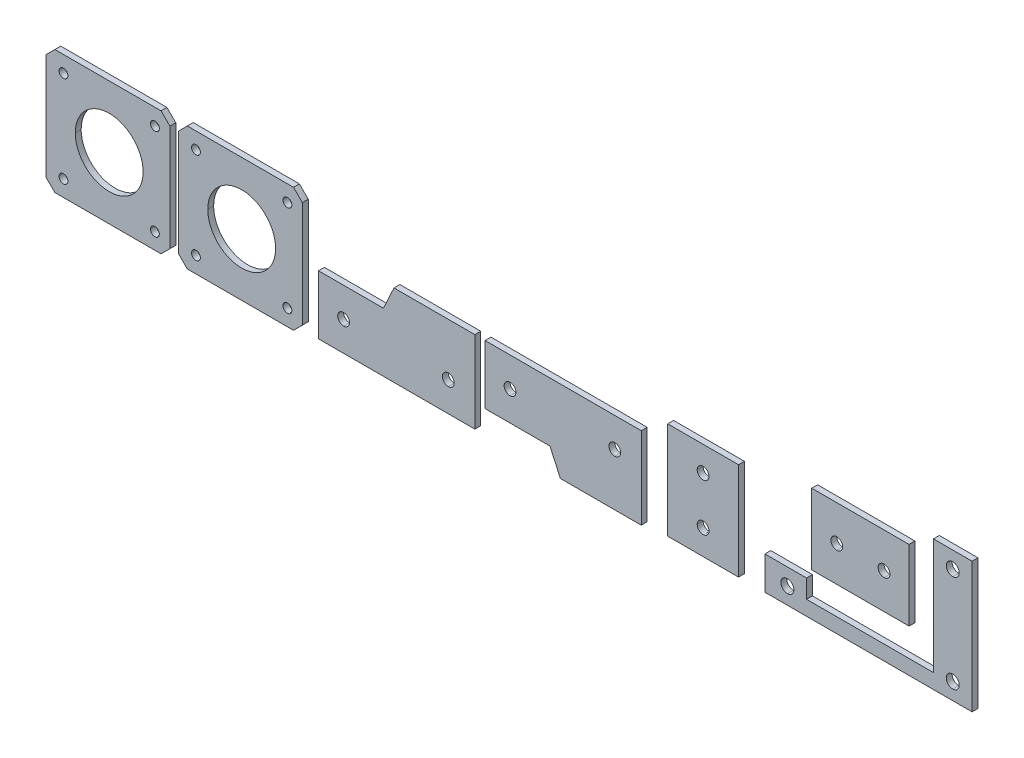
from build123d import *

# Parameters (mm, degrees)
BOSS_EXTRUDE1_DEPTH   = 2
BOSS_EXTRUDE1_2_DEPTH = 2
BOSS_EXTRUDE1_3_DEPTH = 2
BOSS_EXTRUDE1_4_DEPTH = 2
MODEL_W               = 23.999999994
MODEL_H               = 32.999999992
BOSS_EXTRUDE1_5_DEPTH = 2
BOSS_EXTRUDE1_6_DEPTH = 2
BOSS_EXTRUDE1_7_DEPTH = 2


with BuildPart() as part:
    # Model → Boss-Extrude1 (new body)
    with BuildSketch(Plane.XY):
        Polygon((1.931396224, 39.242749239), (1.931396224, 3.242764804), (4.931383092, 0.242742583), (40.931401896, 0.242742583), (43.931391553, 3.242764804), (43.931391553, 39.242749239), (40.931401896, 42.242736183), (4.931383092, 42.242736183), align=None)
        with BuildLine():
            add(Edge.make_bspline(
                [(6.357346111, 36.733899518), (6.357346111, 37.562327573), (7.028893872, 38.233910629), (7.857321907, 38.233910629), (8.685749941, 38.233910629), (9.357332979, 37.562327573), (9.357332979, 36.733899518)],
                knots=[2, 2, 2, 2, 3, 3, 3, 4, 4, 4, 4], degree=3))
            add(Edge.make_bspline(
                [(9.357332979, 36.733899518), (9.357332979, 35.905471463), (8.685749941, 35.233888407), (7.857321907, 35.233888407), (7.028893872, 35.233888407), (6.357346111, 35.905471463), (6.357346111, 36.733899518)],
                knots=[0, 0, 0, 0, 1, 1, 1, 2, 2, 2, 2], degree=3))
        make_face(mode=Mode.SUBTRACT)
        with BuildLine():
            add(Edge.make_bspline(
                [(6.357346111, 5.733905081), (6.357346111, 6.562333137), (7.028893872, 7.233916192), (7.857321907, 7.233916192), (8.685749941, 7.233916192), (9.357332979, 6.562333137), (9.357332979, 5.733905081)],
                knots=[2, 2, 2, 2, 3, 3, 3, 4, 4, 4, 4], degree=3))
            add(Edge.make_bspline(
                [(9.357332979, 5.733905081), (9.357332979, 4.905477026), (8.685749941, 4.23389397), (7.857321907, 4.23389397), (7.028893872, 4.23389397), (6.357346111, 4.905477026), (6.357346111, 5.733905081)],
                knots=[0, 0, 0, 0, 1, 1, 1, 2, 2, 2, 2], degree=3))
        make_face(mode=Mode.SUBTRACT)
        with BuildLine():
            add(Edge.make_bspline(
                [(37.357339765, 5.733905081), (37.357339765, 6.562333137), (38.028887526, 7.233916192), (38.85731556, 7.233916192), (39.685743595, 7.233916192), (40.357326633, 6.562333137), (40.357326633, 5.733905081)],
                knots=[2, 2, 2, 2, 3, 3, 3, 4, 4, 4, 4], degree=3))
            add(Edge.make_bspline(
                [(40.357326633, 5.733905081), (40.357326633, 4.905477026), (39.685743595, 4.23389397), (38.85731556, 4.23389397), (38.028887526, 4.23389397), (37.357339765, 4.905477026), (37.357339765, 5.733905081)],
                knots=[0, 0, 0, 0, 1, 1, 1, 2, 2, 2, 2], degree=3))
        make_face(mode=Mode.SUBTRACT)
        with BuildLine():
            add(Edge.make_bspline(
                [(37.357339765, 36.733899518), (37.357339765, 37.562327573), (38.028922803, 38.233910629), (38.857350838, 38.233910629), (39.685743595, 38.233910629), (40.357326633, 37.562327573), (40.357326633, 36.733899518)],
                knots=[2, 2, 2, 2, 3, 3, 3, 4, 4, 4, 4], degree=3))
            add(Edge.make_bspline(
                [(40.357326633, 36.733899518), (40.357326633, 35.905471463), (39.685743595, 35.233888407), (38.857350838, 35.233888407), (38.028922803, 35.233888407), (37.357339765, 35.905471463), (37.357339765, 36.733899518)],
                knots=[0, 0, 0, 0, 1, 1, 1, 2, 2, 2, 2], degree=3))
        make_face(mode=Mode.SUBTRACT)
        with BuildLine():
            add(Edge.make_bspline(
                [(11.857327916, 21.2339023), (11.857327916, 27.585172298), (17.006048895, 32.733893408), (23.357318733, 32.733893408), (29.708623849, 32.733893408), (34.857344829, 27.585172298), (34.857344829, 21.2339023)],
                knots=[2, 2, 2, 2, 3, 3, 3, 4, 4, 4, 4], degree=3))
            add(Edge.make_bspline(
                [(34.857344829, 21.2339023), (34.857344829, 14.882632301), (29.708623849, 9.733911191), (23.357318733, 9.733911191), (17.006048895, 9.733911191), (11.857327916, 14.882632301), (11.857327916, 21.2339023)],
                knots=[0, 0, 0, 0, 1, 1, 1, 2, 2, 2, 2], degree=3))
        make_face(mode=Mode.SUBTRACT)
    extrude(amount=BOSS_EXTRUDE1_DEPTH)


with BuildPart() as body_2:
    # Model → Boss-Extrude1 2 (new body)
    with BuildSketch(Plane.XY):
        Polygon((46.851770172, 39.251586338), (46.851770172, 3.251601903), (49.85175704, 0.251579681), (85.851775844, 0.251579681), (88.851765501, 3.251601903), (88.851765501, 39.251586338), (85.851775844, 42.251573282), (49.85175704, 42.251573282), align=None)
        with BuildLine():
            add(Edge.make_bspline(
                [(51.277720059, 36.742736617), (51.277720059, 37.571164672), (51.94926782, 38.242747728), (52.777695854, 38.242747728), (53.606123889, 38.242747728), (54.277706927, 37.571164672), (54.277706927, 36.742736617)],
                knots=[2, 2, 2, 2, 3, 3, 3, 4, 4, 4, 4], degree=3))
            add(Edge.make_bspline(
                [(54.277706927, 36.742736617), (54.277706927, 35.914308561), (53.606123889, 35.242725506), (52.777695854, 35.242725506), (51.94926782, 35.242725506), (51.277720059, 35.914308561), (51.277720059, 36.742736617)],
                knots=[0, 0, 0, 0, 1, 1, 1, 2, 2, 2, 2], degree=3))
        make_face(mode=Mode.SUBTRACT)
        with BuildLine():
            add(Edge.make_bspline(
                [(51.277720059, 5.74274218), (51.277720059, 6.571170235), (51.94926782, 7.242753291), (52.777695854, 7.242753291), (53.606123889, 7.242753291), (54.277706927, 6.571170235), (54.277706927, 5.74274218)],
                knots=[2, 2, 2, 2, 3, 3, 3, 4, 4, 4, 4], degree=3))
            add(Edge.make_bspline(
                [(54.277706927, 5.74274218), (54.277706927, 4.914314125), (53.606123889, 4.242731069), (52.777695854, 4.242731069), (51.94926782, 4.242731069), (51.277720059, 4.914314125), (51.277720059, 5.74274218)],
                knots=[0, 0, 0, 0, 1, 1, 1, 2, 2, 2, 2], degree=3))
        make_face(mode=Mode.SUBTRACT)
        with BuildLine():
            add(Edge.make_bspline(
                [(82.277713713, 5.74274218), (82.277713713, 6.571170235), (82.949261473, 7.242753291), (83.777689508, 7.242753291), (84.606117542, 7.242753291), (85.277700581, 6.571170235), (85.277700581, 5.74274218)],
                knots=[2, 2, 2, 2, 3, 3, 3, 4, 4, 4, 4], degree=3))
            add(Edge.make_bspline(
                [(85.277700581, 5.74274218), (85.277700581, 4.914314125), (84.606117542, 4.242731069), (83.777689508, 4.242731069), (82.949261473, 4.242731069), (82.277713713, 4.914314125), (82.277713713, 5.74274218)],
                knots=[0, 0, 0, 0, 1, 1, 1, 2, 2, 2, 2], degree=3))
        make_face(mode=Mode.SUBTRACT)
        with BuildLine():
            add(Edge.make_bspline(
                [(82.277713713, 36.742736617), (82.277713713, 37.571164672), (82.949296751, 38.242747728), (83.777724786, 38.242747728), (84.606117542, 38.242747728), (85.277700581, 37.571164672), (85.277700581, 36.742736617)],
                knots=[2, 2, 2, 2, 3, 3, 3, 4, 4, 4, 4], degree=3))
            add(Edge.make_bspline(
                [(85.277700581, 36.742736617), (85.277700581, 35.914308561), (84.606117542, 35.242725506), (83.777724786, 35.242725506), (82.949296751, 35.242725506), (82.277713713, 35.914308561), (82.277713713, 36.742736617)],
                knots=[0, 0, 0, 0, 1, 1, 1, 2, 2, 2, 2], degree=3))
        make_face(mode=Mode.SUBTRACT)
        with BuildLine():
            add(Edge.make_bspline(
                [(56.777701863, 21.242739398), (56.777701863, 27.594009397), (61.926422843, 32.742730507), (68.277692681, 32.742730507), (74.628997797, 32.742730507), (79.777718777, 27.594009397), (79.777718777, 21.242739398)],
                knots=[2, 2, 2, 2, 3, 3, 3, 4, 4, 4, 4], degree=3))
            add(Edge.make_bspline(
                [(79.777718777, 21.242739398), (79.777718777, 14.8914694), (74.628997797, 9.74274829), (68.277692681, 9.74274829), (61.926422843, 9.74274829), (56.777701863, 14.8914694), (56.777701863, 21.242739398)],
                knots=[0, 0, 0, 0, 1, 1, 1, 2, 2, 2, 2], degree=3))
        make_face(mode=Mode.SUBTRACT)
    extrude(amount=BOSS_EXTRUDE1_2_DEPTH)


with BuildPart() as body_3:
    # Model → Boss-Extrude1 3 (new body)
    with BuildSketch(Plane.XY):
        Polygon((147.329857212, 29.728704883), (119.91242307, 29.728704884), (116.346581415, 21.978705252), (94.346581421, 21.978705253), (94.34658142, 1.978705258), (147.329857211, 1.978704328), align=None)
        with BuildLine():
            add(Edge.make_bspline(
                [(102.829859746, 9.978694834), (103.934429245, 9.978694834), (104.829859746, 10.874125334), (104.829859746, 11.978694833), (104.829859746, 13.083264333), (103.934429245, 13.978694833), (102.829859746, 13.978694833)],
                knots=[2, 2, 2, 2, 3, 3, 3, 4, 4, 4, 4], degree=3))
            add(Edge.make_bspline(
                [(102.829859746, 13.978694833), (101.725290247, 13.978694833), (100.829859747, 13.083264333), (100.829859747, 11.978694834), (100.829859747, 10.874125334), (101.725290247, 9.978694834), (102.829859746, 9.978694834)],
                knots=[0, 0, 0, 0, 1, 1, 1, 2, 2, 2, 2], degree=3))
        make_face(mode=Mode.SUBTRACT)
        with BuildLine():
            add(Edge.make_bspline(
                [(138.329856114, 9.978693487), (139.434425614, 9.978693487), (140.329856114, 10.874123987), (140.329856114, 11.978693486), (140.329856114, 13.083262985), (139.434425614, 13.978693486), (138.329856114, 13.978693486)],
                knots=[2, 2, 2, 2, 3, 3, 3, 4, 4, 4, 4], degree=3))
            add(Edge.make_bspline(
                [(138.329856114, 13.978693486), (137.225286615, 13.978693486), (136.329856115, 13.083262985), (136.329856115, 11.978693486), (136.329856115, 10.874123987), (137.225286615, 9.978693487), (138.329856114, 9.978693487)],
                knots=[0, 0, 0, 0, 1, 1, 1, 2, 2, 2, 2], degree=3))
        make_face(mode=Mode.SUBTRACT)
    extrude(amount=BOSS_EXTRUDE1_3_DEPTH)


with BuildPart() as body_4:
    # Model → Boss-Extrude1 4 (new body)
    with BuildSketch(Plane.XY):
        Polygon((172.78614888, 9.730194251), (176.351990489, 1.980194598), (203.769424676, 1.980194616), (203.769424679, 29.73019517), (150.786148888, 29.730194248), (150.786148886, 9.730194253), align=None)
        with BuildLine():
            add(Edge.make_bspline(
                [(159.269427212, 17.730204672), (158.164857713, 17.730204672), (157.269427213, 18.625635172), (157.269427213, 19.730204671), (157.269427213, 20.834774171), (158.164857713, 21.730204671), (159.269427212, 21.730204671)],
                knots=[0, 0, 0, 0, 1, 1, 1, 2, 2, 2, 2], degree=3))
            add(Edge.make_bspline(
                [(159.269427212, 21.730204671), (160.373996712, 21.730204671), (161.269427212, 20.83477417), (161.269427212, 19.730204671), (161.269427212, 18.625635172), (160.373996711, 17.730204672), (159.269427212, 17.730204672)],
                knots=[2, 2, 2, 2, 3, 3, 3, 4, 4, 4, 4], degree=3))
        make_face(mode=Mode.SUBTRACT)
        with BuildLine():
            add(Edge.make_bspline(
                [(194.76942358, 17.730206014), (193.664854081, 17.730206014), (192.769423581, 18.625636515), (192.769423581, 19.730206014), (192.769423581, 20.834775513), (193.664854081, 21.730206013), (194.769423581, 21.730206013)],
                knots=[0, 0, 0, 0, 1, 1, 1, 2, 2, 2, 2], degree=3))
            add(Edge.make_bspline(
                [(194.769423581, 21.730206013), (195.87399308, 21.730206013), (196.76942358, 20.834775513), (196.76942358, 19.730206014), (196.76942358, 18.625636514), (195.87399308, 17.730206014), (194.76942358, 17.730206014)],
                knots=[2, 2, 2, 2, 3, 3, 3, 4, 4, 4, 4], degree=3))
        make_face(mode=Mode.SUBTRACT)
    extrude(amount=BOSS_EXTRUDE1_4_DEPTH)


with BuildPart() as body_5:
    # Model → Boss-Extrude1 5 (new body)
    with BuildSketch(Plane.XY):
        with Locations((224.726477488, 19.730205441)):
            Rectangle(MODEL_W, MODEL_H)
        with BuildLine():
            add(Edge.make_bspline(
                [(226.72646853, 11.713483967), (226.72646853, 12.818053466), (225.83103803, 13.713483966), (224.726468531, 13.713483966), (223.621899032, 13.713483966), (222.726468531, 12.818053466), (222.726468531, 11.713483967)],
                knots=[0, 0, 0, 0, 1, 1, 1, 2, 2, 2, 2], degree=3))
            add(Edge.make_bspline(
                [(222.726468531, 11.713483967), (222.726468531, 10.608914468), (223.621899031, 9.713483967), (224.726468531, 9.713483967), (225.83103803, 9.713483967), (226.72646853, 10.608914467), (226.72646853, 11.713483967)],
                knots=[2, 2, 2, 2, 3, 3, 3, 4, 4, 4, 4], degree=3))
        make_face(mode=Mode.SUBTRACT)
        with BuildLine():
            add(Edge.make_bspline(
                [(226.726487099, 27.746927003), (226.726487099, 28.851496503), (225.831056599, 29.746927003), (224.726487099, 29.746927003), (223.6219176, 29.746927003), (222.7264871, 28.851496503), (222.7264871, 27.746927004)],
                knots=[0, 0, 0, 0, 1, 1, 1, 2, 2, 2, 2], degree=3))
            add(Edge.make_bspline(
                [(222.7264871, 27.746927004), (222.7264871, 26.642357504), (223.6219176, 25.746927004), (224.726487099, 25.746927004), (225.831056598, 25.746927004), (226.726487099, 26.642357504), (226.726487099, 27.746927003)],
                knots=[2, 2, 2, 2, 3, 3, 3, 4, 4, 4, 4], degree=3))
        make_face(mode=Mode.SUBTRACT)
    extrude(amount=BOSS_EXTRUDE1_5_DEPTH)


with BuildPart() as body_6:
    # Model → Boss-Extrude1 6 (new body)
    with BuildSketch(Plane.XY):
        Polygon((261.555559779, 41.746928221), (294.555559771, 41.74692822), (294.55555977, 17.746928226), (261.555559778, 17.746928227), align=None)
        with BuildLine():
            add(Edge.make_bspline(
                [(286.072281249, 31.746919266), (284.967711749, 31.746919266), (284.072281249, 30.851488766), (284.072281249, 29.746919267), (284.072281249, 28.642349767), (284.967711749, 27.746919267), (286.072281248, 27.746919267)],
                knots=[0, 0, 0, 0, 1, 1, 1, 2, 2, 2, 2], degree=3))
            add(Edge.make_bspline(
                [(286.072281248, 27.746919267), (287.176850747, 27.746919267), (288.072281248, 28.642349767), (288.072281248, 29.746919266), (288.072281248, 30.851488766), (287.176850748, 31.746919266), (286.072281249, 31.746919266)],
                knots=[2, 2, 2, 2, 3, 3, 3, 4, 4, 4, 4], degree=3))
        make_face(mode=Mode.SUBTRACT)
        with BuildLine():
            add(Edge.make_bspline(
                [(270.038838212, 31.746937835), (268.934268713, 31.746937835), (268.038838212, 30.851507335), (268.038838212, 29.746937836), (268.038838212, 28.642368337), (268.934268712, 27.746937836), (270.038838211, 27.746937836)],
                knots=[0, 0, 0, 0, 1, 1, 1, 2, 2, 2, 2], degree=3))
            add(Edge.make_bspline(
                [(270.038838211, 27.746937836), (271.143407711, 27.746937836), (272.038838211, 28.642368336), (272.038838211, 29.746937835), (272.038838211, 30.851507335), (271.143407711, 31.746937835), (270.038838212, 31.746937835)],
                knots=[2, 2, 2, 2, 3, 3, 3, 4, 4, 4, 4], degree=3))
        make_face(mode=Mode.SUBTRACT)
    extrude(amount=BOSS_EXTRUDE1_6_DEPTH)


with BuildPart() as body_7:
    # Model → Boss-Extrude1 7 (new body)
    with BuildSketch(Plane.XY):
        Polygon((259.806397827, 8.247086156), (259.806397827, 14.497108932), (245.681382965, 14.497108932), (245.681382965, 3.247096157), (315.931395895, 3.247096157), (315.931395895, 47.497106424), (302.806369563, 47.497106424), (302.806369563, 8.247086156), align=None)
        with BuildLine():
            add(Edge.make_bspline(
                [(253.306392215, 6.672109768), (252.091355024, 6.672109768), (251.106364216, 7.657065323), (251.106364216, 8.872102545), (251.106364216, 10.087139767), (252.091355024, 11.072095322), (253.306392215, 11.072095322)],
                knots=[2, 2, 2, 2, 3, 3, 3, 4, 4, 4, 4], degree=3))
            add(Edge.make_bspline(
                [(253.306392215, 11.072095322), (254.521394129, 11.072095322), (255.506389495, 10.087139767), (255.506389495, 8.872102545), (255.506389495, 7.657065323), (254.521394129, 6.672109768), (253.306392215, 6.672109768)],
                knots=[0, 0, 0, 0, 1, 1, 1, 2, 2, 2, 2], degree=3))
        make_face(mode=Mode.SUBTRACT)
        with BuildLine():
            add(Edge.make_bspline(
                [(309.368882729, 39.672107259), (308.153845538, 39.672107259), (307.168890008, 40.657062815), (307.168890008, 41.872100037), (307.168890008, 43.087137258), (308.153845538, 44.072092814), (309.368882729, 44.072092814)],
                knots=[2, 2, 2, 2, 3, 3, 3, 4, 4, 4, 4], degree=3))
            add(Edge.make_bspline(
                [(309.368882729, 44.072092814), (310.583919921, 44.072092814), (311.568875451, 43.087137258), (311.568875451, 41.872100037), (311.568875451, 40.657062815), (310.583919921, 39.672107259), (309.368882729, 39.672107259)],
                knots=[0, 0, 0, 0, 1, 1, 1, 2, 2, 2, 2], degree=3))
        make_face(mode=Mode.SUBTRACT)
        with BuildLine():
            add(Edge.make_bspline(
                [(309.368882729, 6.672109768), (308.153845538, 6.672109768), (307.168890008, 7.657065323), (307.168890008, 8.872102545), (307.168890008, 10.087139767), (308.153845538, 11.072095322), (309.368882729, 11.072095322)],
                knots=[2, 2, 2, 2, 3, 3, 3, 4, 4, 4, 4], degree=3))
            add(Edge.make_bspline(
                [(309.368882729, 11.072095322), (310.583919921, 11.072095322), (311.568875451, 10.087139767), (311.568875451, 8.872102545), (311.568875451, 7.657065323), (310.583919921, 6.672109768), (309.368882729, 6.672109768)],
                knots=[0, 0, 0, 0, 1, 1, 1, 2, 2, 2, 2], degree=3))
        make_face(mode=Mode.SUBTRACT)
    extrude(amount=BOSS_EXTRUDE1_7_DEPTH)


solid = Compound([part.part, body_2.part, body_3.part, body_4.part, body_5.part, body_6.part, body_7.part])
